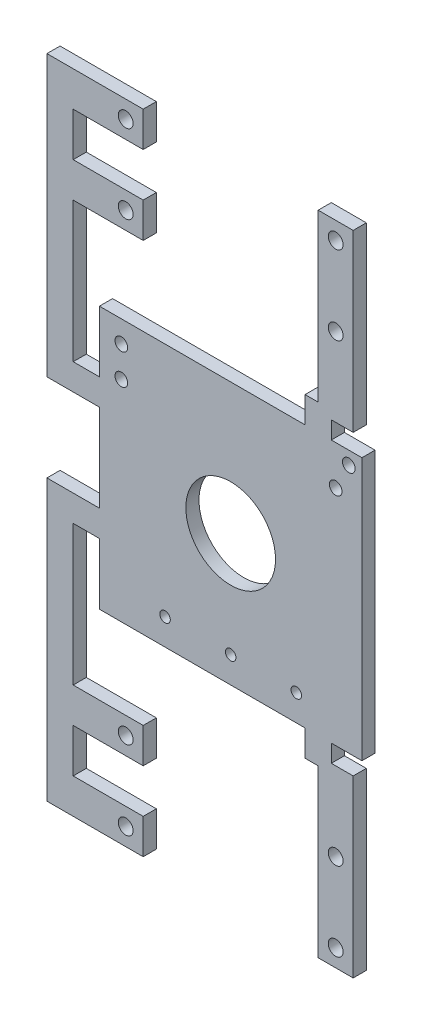
from build123d import *

# Parameters (mm, degrees)
SKETCH1_W                                 = 60
SKETCH1_H                                 = 60
BOSS_EXTRUDE1_DEPTH                       = 3
SKETCH2_R                                 = 10.25
CUT_EXTRUDE1_DEPTH                        = 43.532340636
SKETCH4_R                                 = 1.45
STOP_MOUNT_D2P9_THROUGH_DEPTH             = 3.01
SKETCH5_R                                 = 1.45
SERVO_X_MOUNT_D2P9_DEPTH                  = 3.01
SKETCH6_R                                 = 1.2
GUIDERAIL2_D2P4_DEPTH                     = 3.01
SKETCH12_W                                = 15
SKETCH12_H                                = 6
ROUTED_FRAME_EAR_LEFTPLUS_ROOT_DEPTH      = 3
SKETCH13_W                                = 6
SKETCH13_H                                = 46
ROUTED_FRAME_EAR_LEFTPLUS_OUTBOARD_DEPTH  = 3
SKETCH14_W                                = 22
SKETCH14_H                                = 8
ROUTED_FRAME_EAR_LEFTPLUS_PAD_DEPTH       = 3
SKETCH15_W                                = 15
SKETCH15_H                                = 6
ROUTED_FRAME_EAR_LEFTMINUS_ROOT_DEPTH     = 3
SKETCH16_W                                = 6
SKETCH16_H                                = 46
ROUTED_FRAME_EAR_LEFTMINUS_OUTBOARD_DEPTH = 3
SKETCH17_W                                = 22
SKETCH17_H                                = 8
ROUTED_FRAME_EAR_LEFTMINUS_PAD_DEPTH      = 3
SKETCH18_W                                = 6
SKETCH18_H                                = 8
ROUTED_FRAME_EAR_RIGHTPLUS_ROOT_DEPTH     = 3
SKETCH19_W                                = 8
SKETCH19_H                                = 22
ROUTED_FRAME_EAR_RIGHTPLUS_PAD_DEPTH      = 3
SKETCH20_W                                = 6
SKETCH20_H                                = 8
ROUTED_FRAME_EAR_RIGHTMINUS_ROOT_DEPTH    = 3
SKETCH21_W                                = 8
SKETCH21_H                                = 22
ROUTED_FRAME_EAR_RIGHTMINUS_PAD_DEPTH     = 3
SKETCH22_R                                = 1.7
ROUTED_FRAME_EARS_D3P4_DEPTH              = 3.01
SKETCH23_W                                = 6
SKETCH23_H                                = 20
FOUR_LINK_SUPPORT_PLUS_LEFTRAIL_DEPTH     = 3
SKETCH24_W                                = 22
SKETCH24_H                                = 8
FOUR_LINK_SUPPORT_PLUS_LEFTPAD_DEPTH      = 3
SKETCH25_W                                = 8
SKETCH25_H                                = 20
FOUR_LINK_SUPPORT_PLUS_RIGHTRAIL_DEPTH    = 3
SKETCH26_W                                = 6
SKETCH26_H                                = 20
FOUR_LINK_SUPPORT_MINUS_LEFTRAIL_DEPTH    = 3
SKETCH27_W                                = 22
SKETCH27_H                                = 8
FOUR_LINK_SUPPORT_MINUS_LEFTPAD_DEPTH     = 3
SKETCH28_W                                = 8
SKETCH28_H                                = 20
FOUR_LINK_SUPPORT_MINUS_RIGHTRAIL_DEPTH   = 3
SKETCH29_R                                = 1.7
FOUR_LINK_SUPPORT_HOLES_Y70_DEPTH         = 3.01


with BuildPart() as part:
    # Sketch1 → Boss-Extrude1 (new body)
    with BuildSketch(Plane.XY):
        Rectangle(SKETCH1_W, SKETCH1_H)
    extrude(amount=BOSS_EXTRUDE1_DEPTH)

    # Sketch2 → Cut-Extrude1 (cut, through all)
    with BuildSketch(Plane.XY.offset(3)):
        Circle(SKETCH2_R)
    extrude(amount=-CUT_EXTRUDE1_DEPTH, mode=Mode.SUBTRACT)

    # Sketch4 → Stop_Mount_D2p9_Through (cut)
    with BuildSketch(Plane(origin=(0, 0, 0), x_dir=(-1, 0, 0), z_dir=(0, 0, -1))):
        with Locations((-24, 21)):
            Circle(SKETCH4_R)
        with Locations((-27, 27)):
            Circle(SKETCH4_R)
    extrude(amount=-STOP_MOUNT_D2P9_THROUGH_DEPTH, mode=Mode.SUBTRACT)

    # Sketch5 → Servo_X_Mount_D2p9 (cut)
    with BuildSketch(Plane(origin=(0, 0, 0), x_dir=(-1, 0, 0), z_dir=(0, 0, -1))):
        with Locations((25, 18)):
            Circle(SKETCH5_R)
        with Locations((25, 25)):
            Circle(SKETCH5_R)
    extrude(amount=-SERVO_X_MOUNT_D2P9_DEPTH, mode=Mode.SUBTRACT)

    # Sketch6 → GuideRail2_D2p4 (cut)
    with BuildSketch(Plane.XY.offset(3)):
        with Locations((15, -24)):
            Circle(SKETCH6_R)
        with Locations((0, -24)):
            Circle(SKETCH6_R)
        with Locations((-15, -24)):
            Circle(SKETCH6_R)
    extrude(amount=-GUIDERAIL2_D2P4_DEPTH, mode=Mode.SUBTRACT)

    # Sketch12 → Routed_Frame_Ear_LeftPlus_Root (add)
    with BuildSketch(Plane.XY):
        with Locations((-34.5, 13)):
            Rectangle(SKETCH12_W, SKETCH12_H)
    extrude(amount=ROUTED_FRAME_EAR_LEFTPLUS_ROOT_DEPTH)

    # Sketch13 → Routed_Frame_Ear_LeftPlus_Outboard (add)
    with BuildSketch(Plane.XY):
        with Locations((-39, 33)):
            Rectangle(SKETCH13_W, SKETCH13_H)
    extrude(amount=ROUTED_FRAME_EAR_LEFTPLUS_OUTBOARD_DEPTH)

    # Sketch14 → Routed_Frame_Ear_LeftPlus_Pad (add)
    with BuildSketch(Plane.XY):
        with Locations((-31, 52)):
            Rectangle(SKETCH14_W, SKETCH14_H)
    extrude(amount=ROUTED_FRAME_EAR_LEFTPLUS_PAD_DEPTH)

    # Sketch15 → Routed_Frame_Ear_LeftMinus_Root (add)
    with BuildSketch(Plane.XY):
        with Locations((-34.5, -13)):
            Rectangle(SKETCH15_W, SKETCH15_H)
    extrude(amount=ROUTED_FRAME_EAR_LEFTMINUS_ROOT_DEPTH)

    # Sketch16 → Routed_Frame_Ear_LeftMinus_Outboard (add)
    with BuildSketch(Plane.XY):
        with Locations((-39, -33)):
            Rectangle(SKETCH16_W, SKETCH16_H)
    extrude(amount=ROUTED_FRAME_EAR_LEFTMINUS_OUTBOARD_DEPTH)

    # Sketch17 → Routed_Frame_Ear_LeftMinus_Pad (add)
    with BuildSketch(Plane.XY):
        with Locations((-31, -52)):
            Rectangle(SKETCH17_W, SKETCH17_H)
    extrude(amount=ROUTED_FRAME_EAR_LEFTMINUS_PAD_DEPTH)

    # Sketch18 → Routed_Frame_Ear_RightPlus_Root (add)
    with BuildSketch(Plane.XY):
        with Locations((20, 32)):
            Rectangle(SKETCH18_W, SKETCH18_H)
    extrude(amount=ROUTED_FRAME_EAR_RIGHTPLUS_ROOT_DEPTH)

    # Sketch19 → Routed_Frame_Ear_RightPlus_Pad (add)
    with BuildSketch(Plane.XY):
        with Locations((24, 45)):
            Rectangle(SKETCH19_W, SKETCH19_H)
    extrude(amount=ROUTED_FRAME_EAR_RIGHTPLUS_PAD_DEPTH)

    # Sketch20 → Routed_Frame_Ear_RightMinus_Root (add)
    with BuildSketch(Plane.XY):
        with Locations((20, -32)):
            Rectangle(SKETCH20_W, SKETCH20_H)
    extrude(amount=ROUTED_FRAME_EAR_RIGHTMINUS_ROOT_DEPTH)

    # Sketch21 → Routed_Frame_Ear_RightMinus_Pad (add)
    with BuildSketch(Plane.XY):
        with Locations((24, -45)):
            Rectangle(SKETCH21_W, SKETCH21_H)
    extrude(amount=ROUTED_FRAME_EAR_RIGHTMINUS_PAD_DEPTH)

    # Sketch22 → Routed_Frame_Ears_D3p4 (cut)
    with BuildSketch(Plane.XY.offset(3)):
        with Locations((-24, -52)):
            Circle(SKETCH22_R)
        with Locations((-24, 52)):
            Circle(SKETCH22_R)
        with Locations((24, -52)):
            Circle(SKETCH22_R)
        with Locations((24, 52)):
            Circle(SKETCH22_R)
    extrude(amount=-ROUTED_FRAME_EARS_D3P4_DEPTH, mode=Mode.SUBTRACT)

    # Sketch23 → Four_Link_Support_Plus_LeftRail (add)
    with BuildSketch(Plane.XY):
        with Locations((-39, 64)):
            Rectangle(SKETCH23_W, SKETCH23_H)
    extrude(amount=FOUR_LINK_SUPPORT_PLUS_LEFTRAIL_DEPTH)

    # Sketch24 → Four_Link_Support_Plus_LeftPad (add)
    with BuildSketch(Plane.XY):
        with Locations((-31, 70)):
            Rectangle(SKETCH24_W, SKETCH24_H)
    extrude(amount=FOUR_LINK_SUPPORT_PLUS_LEFTPAD_DEPTH)

    # Sketch25 → Four_Link_Support_Plus_RightRail (add)
    with BuildSketch(Plane.XY):
        with Locations((24, 64)):
            Rectangle(SKETCH25_W, SKETCH25_H)
    extrude(amount=FOUR_LINK_SUPPORT_PLUS_RIGHTRAIL_DEPTH)

    # Sketch26 → Four_Link_Support_Minus_LeftRail (add)
    with BuildSketch(Plane.XY):
        with Locations((-39, -64)):
            Rectangle(SKETCH26_W, SKETCH26_H)
    extrude(amount=FOUR_LINK_SUPPORT_MINUS_LEFTRAIL_DEPTH)

    # Sketch27 → Four_Link_Support_Minus_LeftPad (add)
    with BuildSketch(Plane.XY):
        with Locations((-31, -70)):
            Rectangle(SKETCH27_W, SKETCH27_H)
    extrude(amount=FOUR_LINK_SUPPORT_MINUS_LEFTPAD_DEPTH)

    # Sketch28 → Four_Link_Support_Minus_RightRail (add)
    with BuildSketch(Plane.XY):
        with Locations((24, -64)):
            Rectangle(SKETCH28_W, SKETCH28_H)
    extrude(amount=FOUR_LINK_SUPPORT_MINUS_RIGHTRAIL_DEPTH)

    # Sketch29 → Four_Link_Support_Holes_Y70 (cut)
    with BuildSketch(Plane.XY.offset(3)):
        with Locations((-24, -70)):
            Circle(SKETCH29_R)
        with Locations((-24, 70)):
            Circle(SKETCH29_R)
        with Locations((24, -70)):
            Circle(SKETCH29_R)
        with Locations((24, 70)):
            Circle(SKETCH29_R)
    extrude(amount=-FOUR_LINK_SUPPORT_HOLES_Y70_DEPTH, mode=Mode.SUBTRACT)


solid = part.part
